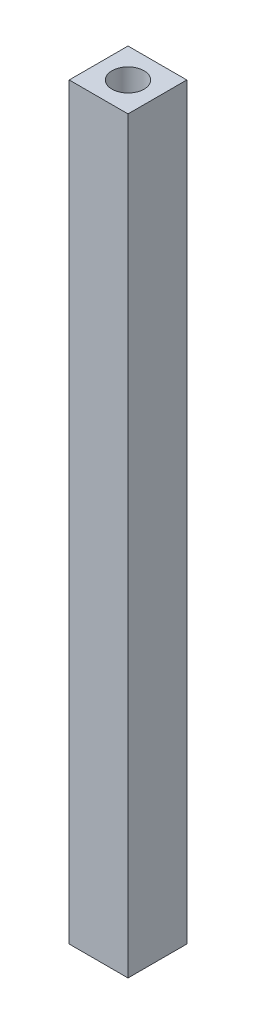
from build123d import *

# Parameters (mm, degrees)
SKETCH1_W           = 5.5
SKETCH1_H           = 5.5
BOSS_EXTRUDE1_DEPTH = 35
SKETCH3_R           = 1.5
CUT_EXTRUDE1_DEPTH  = 10


with BuildPart() as part:
    # Sketch1 → Boss-Extrude1 (new, symmetric)
    with BuildSketch(Plane(origin=(0, 0, 0), x_dir=(1, 0, 0), z_dir=(0, 1, 0))):
        Rectangle(SKETCH1_W, SKETCH1_H)
    extrude(amount=BOSS_EXTRUDE1_DEPTH, both=True)

    # Sketch3 → Cut-Extrude1 (cut)
    with BuildSketch(Plane(origin=(0, 35, 0), x_dir=(1, 0, 0), z_dir=(0, 1, 0))):
        with Locations(Location((0, 0, 0), (0, 0, 270))):
            Circle(SKETCH3_R)
    cut_extrude1 = extrude(amount=-CUT_EXTRUDE1_DEPTH, mode=Mode.SUBTRACT)

    # Mirror1: Cut-Extrude1 across plane
    add(cut_extrude1.mirror(Plane.ZX), mode=Mode.SUBTRACT)


solid = part.part
